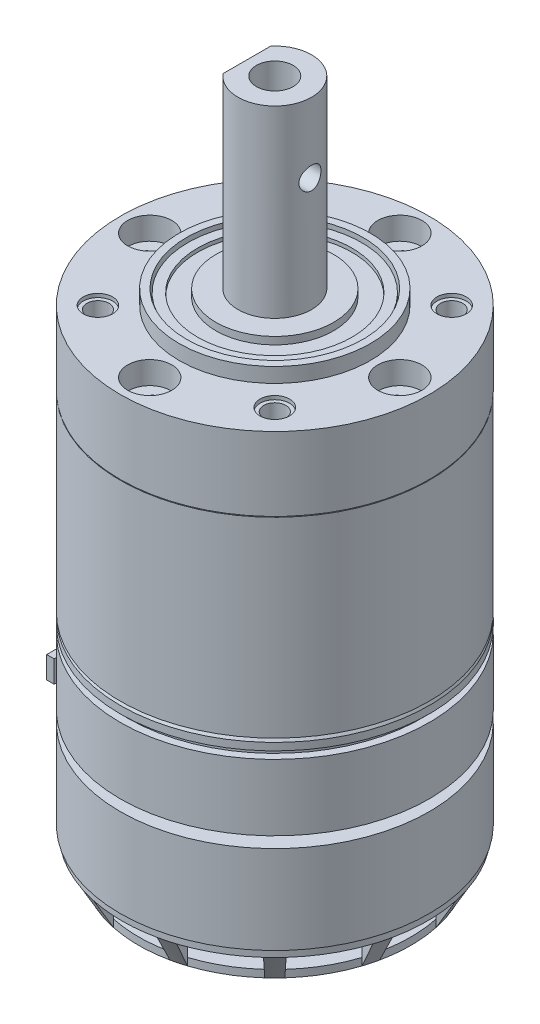
from build123d import *
from build123d.topology import SkipClean

# Parameters (mm, degrees)
SKETCH_1_R                   = 21
EXTRUDE_1_DEPTH              = 12
SKETCH_2_R                   = 10
EXTRUDE_2_DEPTH              = 1.5
SKETCH_3_R                   = 21
EXTRUDE_3_DEPTH              = 9
SKETCH_4_R                   = 20
EXTRUDE_4_DEPTH              = 1
SKETCH_5_R                   = 21
EXTRUDE_5_DEPTH              = 1
SKETCH_7_R                   = 21
EXTRUDE_6_DEPTH              = 26
SKETCH_8_R                   = 20.5
EXTRUDE_7_DEPTH              = 0.1
SKETCH_9_R                   = 21
EXTRUDE_8_DEPTH              = 10
SKETCH_11_R                  = 13
EXTRUDE_9_DEPTH              = 2
SKETCH_12_R                  = 12
SKETCH_12_R_2                = 8
CUT_EXTRUDE_1_DEPTH          = 1
EXTRUDE_START                = 0.5
SKETCH_13_R                  = 12
SKETCH_13_R_2                = 10.5
EXTRUDE_10_DEPTH             = 0.5
SKETCH_14_R                  = 12
SKETCH_14_R_2                = 11.8
CUT_EXTRUDE_2_DEPTH          = 2
SKETCH_15_R                  = 5
EXTRUDE_11_DEPTH             = 5
EXTRUDE_12_DEPTH             = 20
SKETCH_17_R                  = 1.5
CUT_EXTRUDE_3_DEPTH          = 9
SKETCH_18_R                  = 20.75
SKETCH_18_R_2                = 18.5
EXTRUDE_16_DEPTH             = 1
SKETCH_24_R                  = 18.5
EXTRUDE_17_DEPTH             = 1
CUT_EXTRUDE_START            = -4
CUT_EXTRUDE_5_DEPTH          = 4
SKETCH_26_W                  = 10
SKETCH_26_H                  = 3
CUT_EXTRUDE_6_DEPTH          = 21
SKETCH_27_R                  = 3
CUT_EXTRUDE_7_DEPTH          = 5
SKETCH_27_3_R                = 2
CUT_EXTRUDE_8_DEPTH          = 0.5
SKETCH_28_R                  = 1.5
CUT_EXTRUDE_9_DEPTH          = 4
SKETCH_29_R                  = 2.9
EXTRUDE_18_DEPTH             = 2
SKETCH_30_R                  = 3.4
EXTRUDE_19_DEPTH             = 5
EXTRUDE_19_DIRECTION_2_REACH = 99.722
SKETCH_31_R                  = 1.5
CUT_EXTRUDE_10_DEPTH         = 10
SKETCH_32_R                  = 2.5
CUT_EXTRUDE_11_DEPTH         = 50
SKETCH_33_W                  = 7.163468796
SKETCH_33_H                  = 3
SKETCH_33_W_2                = 2.188120942
SKETCH_33_H_2                = 0.9163665
SKETCH_33_W_3                = 3.449299886
SKETCH_33_H_3                = 0.550750586
EXTRUDE_20_DEPTH             = 1
EXTRUDE_21_REACH             = 94.971
EXTRUDE_21_END_RADIUS        = 22.5
SKETCH_36_W                  = 14
SKETCH_36_H                  = 4
SKETCH_36_R                  = 1.5
EXTRUDE_22_REACH             = 95.321
EXTRUDE_22_END_RADIUS        = 24
SKETCH_37_R                  = 1


with BuildPart() as part:
    # 草图1 → 凸台-拉伸1 (new body)
    with BuildSketch(Plane(origin=(0, 0, 0), x_dir=(1, 0, 0), z_dir=(0, 1, 0))):
        with Locations(Location((0, 0, 0), (0, 0, 270))):
            Circle(SKETCH_1_R)
    extrude(amount=EXTRUDE_1_DEPTH)

    # 草图2 → 凸台-拉伸2 (add)
    with BuildSketch(Plane(origin=(0, 12, 0), x_dir=(1, 0, 0), z_dir=(0, 1, 0))):
        with Locations(Location((0, 0, 0), (0, 0, 270))):
            Circle(SKETCH_2_R)
    extrude(amount=EXTRUDE_2_DEPTH)

    # 草图3 → 凸台-拉伸3 (add)
    with BuildSketch(Plane(origin=(0, 13.5, 0), x_dir=(1, 0, 0), z_dir=(0, 1, 0))):
        with Locations(Location((0, 0, 0), (0, 0, 270))):
            Circle(SKETCH_3_R)
    extrude(amount=EXTRUDE_3_DEPTH)

    # 草图4 → 凸台-拉伸4 (add)
    with BuildSketch(Plane(origin=(0, 22.5, 0), x_dir=(1, 0, 0), z_dir=(0, 1, 0))):
        with Locations(Location((0, 0, 0), (0, 0, 270))):
            Circle(SKETCH_4_R)
    extrude(amount=EXTRUDE_4_DEPTH)

    # 草图5 → 凸台-拉伸5 (add)
    with BuildSketch(Plane(origin=(0, 23.5, 0), x_dir=(1, 0, 0), z_dir=(0, 1, 0))):
        with Locations(Location((0, 0, 0), (0, 0, 270))):
            Circle(SKETCH_5_R)
    extrude(amount=EXTRUDE_5_DEPTH)

    # 草图6 → 旋转1 (revolve)
    with BuildSketch(Plane(origin=(0, 0, 0), x_dir=(0, 0, -1), z_dir=(1, 0, 0))):
        Polygon((-21, 24.5), (-20.711324865, 25), (0, 25), (0, 24.5), align=None)
    revolve(axis=Axis((0, 25, 0), (0, -1, 0)))

    # 草图7 → 凸台-拉伸6 (add)
    with BuildSketch(Plane(origin=(0, 25, 0), x_dir=(1, 0, 0), z_dir=(0, 1, 0))):
        with Locations(Location((0, 0, 0), (0, 0, 270))):
            Circle(SKETCH_7_R)
    extrude(amount=EXTRUDE_6_DEPTH)

    # 草图8 → 凸台-拉伸7 (add)
    with BuildSketch(Plane(origin=(0, 51, 0), x_dir=(1, 0, 0), z_dir=(0, 1, 0))):
        with Locations(Location((0, 0, 0), (0, 0, 270))):
            Circle(SKETCH_8_R)
    extrude(amount=EXTRUDE_7_DEPTH)

    # 草图9 → 凸台-拉伸8 (add)
    with BuildSketch(Plane(origin=(0, 51.1, 0), x_dir=(1, 0, 0), z_dir=(0, 1, 0))):
        with Locations(Location((0, 0, 0), (0, 0, 270))):
            Circle(SKETCH_9_R)
    extrude(amount=EXTRUDE_8_DEPTH)

    # 草图11 → 凸台-拉伸9 (add)
    with BuildSketch(Plane(origin=(0, 61.1, 0), x_dir=(1, 0, 0), z_dir=(0, 1, 0))):
        with Locations(Location((0, 0, 0), (0, 0, 270))):
            Circle(SKETCH_11_R)
    extrude(amount=EXTRUDE_9_DEPTH)

    # 草图12 → 切除-拉伸1 (cut)
    with BuildSketch(Plane(origin=(0, 63.1, 0), x_dir=(1, 0, 0), z_dir=(0, 1, 0))):
        with Locations(Location((0, 0, 0), (0, 0, 270))):
            Circle(SKETCH_12_R)
        with Locations(Location((0, 0, 0), (0, 0, 270))):
            Circle(SKETCH_12_R_2, mode=Mode.SUBTRACT)
    extrude(amount=-CUT_EXTRUDE_1_DEPTH, mode=Mode.SUBTRACT)

    # 草图13 → 凸台-拉伸10 (add)
    with BuildSketch(Plane(origin=(0, 62.1, 0), x_dir=(1, 0, 0), z_dir=(0, 1, 0)).offset(EXTRUDE_START)):
        with Locations(Location((0, 0, 0), (0, 0, 270))):
            Circle(SKETCH_13_R)
        with Locations(Location((0, 0, 0), (0, 0, 270))):
            Circle(SKETCH_13_R_2, mode=Mode.SUBTRACT)
    extrude(amount=-EXTRUDE_10_DEPTH)

    # 草图14 → 切除-拉伸2 (cut)
    with BuildSketch(Plane(origin=(0, 62.6, 0), x_dir=(1, 0, 0), z_dir=(0, 1, 0))):
        with Locations(Location((0, 0, 0), (0, 0, 270))):
            Circle(SKETCH_14_R)
        with Locations(Location((0, 0, 0), (0, 0, 270))):
            Circle(SKETCH_14_R_2, mode=Mode.SUBTRACT)
    extrude(amount=-CUT_EXTRUDE_2_DEPTH, mode=Mode.SUBTRACT)

    # 草图15 → 凸台-拉伸11 (add)
    with BuildSketch(Plane(origin=(0, 63.1, 0), x_dir=(1, 0, 0), z_dir=(0, 1, 0))):
        with Locations(Location((0, 0, 0), (0, 0, 270))):
            Circle(SKETCH_15_R)
    extrude(amount=EXTRUDE_11_DEPTH)

    # 草图16 → 凸台-拉伸12 (add)
    with BuildSketch(Plane(origin=(0, 68.1, 0), x_dir=(1, 0, 0), z_dir=(0, 1, 0))):
        with BuildLine():
            Line((-3.8, 3.249615362), (-3.8, -3.249615362))
            ThreePointArc((-3.8, -3.249615362), (5, 0), (-3.8, 3.249615362))
        make_face()
    extrude(amount=EXTRUDE_12_DEPTH)

    # 草图17 → 切除-拉伸3 (cut)
    with BuildSketch(Plane.ZY.offset(3.8)):
        with Locations((0, 78.6)):
            Circle(SKETCH_17_R)
    extrude(amount=-CUT_EXTRUDE_3_DEPTH, mode=Mode.SUBTRACT)

    # 草图18 → 凸台-拉伸16 (add)
    with BuildSketch(Plane.XZ):
        with Locations(Location((0, 0, 0), (0, 0, 90))):
            Circle(SKETCH_18_R)
        with Locations(Location((0, 0, 0), (0, 0, 270))):
            Circle(SKETCH_18_R_2, mode=Mode.SUBTRACT)
    extrude(amount=EXTRUDE_16_DEPTH)

    # 草图23 → 旋转2 (revolve)
    with SkipClean():  # the faces are left unmerged after this step: merging them gives an invalid solid
        with BuildSketch(Plane(origin=(0, 0, 0), x_dir=(0, 0, -1), z_dir=(1, 0, 0)), mode=Mode.PRIVATE) as revolve_2_sk:
            Polygon((-18.5, -5), (-20.75, -1), (-18.5, -1), align=None)
        revolve(revolve_2_sk.sketch.rotate(Axis((0, 0, 0), (0, -1, 0)), 130.535802111), axis=Axis((0, 0, 0), (0, -1, 0)))

    # 草图24 → 凸台-拉伸17 (add)
    with BuildSketch(Plane(origin=(0, -4, 0), x_dir=(-1, 0, 0), z_dir=(0, -1, 0))):
        with Locations(Location((0, 0, 0), (0, 0, 90))):
            Circle(SKETCH_24_R)
    extrude(amount=EXTRUDE_17_DEPTH)

    # 草图25 → 切除-拉伸5 (cut)
    with SkipClean():  # the faces are left unmerged after this step: merging them gives an invalid solid
        with BuildSketch(Plane.XZ.offset(5).offset(CUT_EXTRUDE_START)):
            with BuildLine():
                Line((-5.716814396, 17.594545551), (-6.412102633, 19.734422713))
                ThreePointArc((-6.412102633, 19.734422713), (-10.375, 17.970027129), (-13.884460082, 15.420255129))
                Line((-13.884460082, 15.420255129), (-12.378916218, 13.748179271))
                ThreePointArc((-12.378916218, 13.748179271), (-9.25, 16.02146997), (-5.716814396, 17.594545551))
            make_face()
            with BuildLine():
                ThreePointArc((4.314167584, 20.296562715), (2.168965613, 20.636329329), (0, 20.75))
                Line((0, 20.75), (0, 18.5))
                ThreePointArc((0, 18.5), (1.93377657, 18.398655064), (3.84636628, 18.095730614))
                Line((3.84636628, 18.095730614), (4.314167584, 20.296562715))
            make_face()
            with BuildLine():
                Line((0, 18.5), (0, 20.75))
                ThreePointArc((0, 20.75), (-2.168965613, 20.636329329), (-4.314167584, 20.296562715))
                Line((-4.314167584, 20.296562715), (-3.84636628, 18.095730614))
                ThreePointArc((-3.84636628, 18.095730614), (-1.93377657, 18.398655064), (0, 18.5))
            make_face()
            with BuildLine():
                ThreePointArc((13.884460082, 15.420255129), (10.375, 17.970027129), (6.412102633, 19.734422713))
                Line((6.412102633, 19.734422713), (5.716814396, 17.594545551))
                ThreePointArc((5.716814396, 17.594545551), (9.25, 16.02146997), (12.378916218, 13.748179271))
                Line((12.378916218, 13.748179271), (13.884460082, 15.420255129))
            make_face()
            with BuildLine():
                ThreePointArc((19.734422713, 6.412102633), (17.970027129, 10.375), (15.420255129, 13.884460082))
                Line((15.420255129, 13.884460082), (13.748179271, 12.378916218))
                ThreePointArc((13.748179271, 12.378916218), (16.02146997, 9.25), (17.594545551, 5.716814396))
                Line((17.594545551, 5.716814396), (19.734422713, 6.412102633))
            make_face()
            with BuildLine():
                ThreePointArc((20.75, 0), (20.636329329, 2.168965613), (20.296562715, 4.314167584))
                Line((20.296562715, 4.314167584), (18.095730614, 3.84636628))
                ThreePointArc((18.095730614, 3.84636628), (18.398655064, 1.93377657), (18.5, 0))
                ThreePointArc((18.5, 0), (18.398655064, -1.93377657), (18.095730614, -3.84636628))
                Line((18.095730614, -3.84636628), (20.296562715, -4.314167584))
                ThreePointArc((20.296562715, -4.314167584), (20.636329329, -2.168965613), (20.75, 0))
            make_face()
            with BuildLine():
                ThreePointArc((17.594545551, -5.716814396), (16.02146997, -9.25), (13.748179271, -12.378916218))
                Line((13.748179271, -12.378916218), (15.420255129, -13.884460082))
                ThreePointArc((15.420255129, -13.884460082), (17.970027129, -10.375), (19.734422713, -6.412102633))
                Line((19.734422713, -6.412102633), (17.594545551, -5.716814396))
            make_face()
            with BuildLine():
                ThreePointArc((12.378916218, -13.748179271), (9.25, -16.02146997), (5.716814396, -17.594545551))
                Line((5.716814396, -17.594545551), (6.412102633, -19.734422713))
                ThreePointArc((6.412102633, -19.734422713), (10.375, -17.970027129), (13.884460082, -15.420255129))
                Line((13.884460082, -15.420255129), (12.378916218, -13.748179271))
            make_face()
            with BuildLine():
                ThreePointArc((3.84636628, -18.095730614), (1.93377657, -18.398655064), (0, -18.5))
                Line((0, -18.5), (0, -20.75))
                ThreePointArc((0, -20.75), (2.168965613, -20.636329329), (4.314167584, -20.296562715))
                Line((4.314167584, -20.296562715), (3.84636628, -18.095730614))
            make_face()
            with BuildLine():
                Line((0, -20.75), (0, -18.5))
                ThreePointArc((0, -18.5), (-1.93377657, -18.398655064), (-3.84636628, -18.095730614))
                Line((-3.84636628, -18.095730614), (-4.314167584, -20.296562715))
                ThreePointArc((-4.314167584, -20.296562715), (-2.168965613, -20.636329329), (0, -20.75))
            make_face()
            with BuildLine():
                Line((-6.412102633, -19.734422713), (-5.716814396, -17.594545551))
                ThreePointArc((-5.716814396, -17.594545551), (-9.25, -16.02146997), (-12.378916218, -13.748179271))
                Line((-12.378916218, -13.748179271), (-13.884460082, -15.420255129))
                ThreePointArc((-13.884460082, -15.420255129), (-10.375, -17.970027129), (-6.412102633, -19.734422713))
            make_face()
            with BuildLine():
                Line((-15.420255129, -13.884460082), (-13.748179271, -12.378916218))
                ThreePointArc((-13.748179271, -12.378916218), (-16.02146997, -9.25), (-17.594545551, -5.716814396))
                Line((-17.594545551, -5.716814396), (-19.734422713, -6.412102633))
                ThreePointArc((-19.734422713, -6.412102633), (-17.970027129, -10.375), (-15.420255129, -13.884460082))
            make_face()
            with BuildLine():
                Line((-18.095730614, 3.84636628), (-20.296562715, 4.314167584))
                ThreePointArc((-20.296562715, 4.314167584), (-20.75, 0), (-20.296562715, -4.314167584))
                Line((-20.296562715, -4.314167584), (-18.095730614, -3.84636628))
                ThreePointArc((-18.095730614, -3.84636628), (-18.5, 0), (-18.095730614, 3.84636628))
            make_face()
            with BuildLine():
                Line((-13.748179271, 12.378916218), (-15.420255129, 13.884460082))
                ThreePointArc((-15.420255129, 13.884460082), (-17.970027129, 10.375), (-19.734422713, 6.412102633))
                Line((-19.734422713, 6.412102633), (-17.594545551, 5.716814396))
                ThreePointArc((-17.594545551, 5.716814396), (-16.02146997, 9.25), (-13.748179271, 12.378916218))
            make_face()
        extrude(amount=CUT_EXTRUDE_5_DEPTH, mode=Mode.SUBTRACT)

    # 草图26 → 切除-拉伸6 (cut)
    with SkipClean():  # the faces are left unmerged after this step: merging them gives an invalid solid
        with BuildSketch(Plane(origin=(0, 0, 0), x_dir=(0, 0, -1), z_dir=(1, 0, 0))):
            with Locations((-10, 18)):
                Rectangle(SKETCH_26_W, SKETCH_26_H)
        extrude(amount=-CUT_EXTRUDE_6_DEPTH, mode=Mode.SUBTRACT)

    # 草图27 → 切除-拉伸7 (cut)
    with SkipClean():  # the faces are left unmerged after this step: merging them gives an invalid solid
        with BuildSketch(Plane(origin=(0, 61.1, 0), x_dir=(1, 0, 0), z_dir=(0, 1, 0))):
            with Locations(Location((0, 17, 0), (0, 0, 270))):
                Circle(SKETCH_27_R)
            with Locations(Location((-17, 0, 0), (0, 0, 270))):
                Circle(SKETCH_27_R)
            with Locations(Location((0, -17, 0), (0, 0, 270))):
                Circle(SKETCH_27_R)
            with Locations(Location((17, 0, 0), (0, 0, 270))):
                Circle(SKETCH_27_R)
        extrude(amount=-CUT_EXTRUDE_7_DEPTH, mode=Mode.SUBTRACT)

    # 草图27<3> → 切除-拉伸8 (cut)
    with SkipClean():  # the faces are left unmerged after this step: merging them gives an invalid solid
        with BuildSketch(Plane(origin=(0, 61.1, 0), x_dir=(1, 0, 0), z_dir=(0, 1, 0))):
            with Locations(Location((-12.02081528, 12.02081528, 0), (0, 0, 270))):
                Circle(SKETCH_27_3_R)
            with Locations(Location((12.02081528, -12.02081528, 0), (0, 0, 270))):
                Circle(SKETCH_27_3_R)
            with Locations(Location((-12.02081528, -12.02081528, 0), (0, 0, 270))):
                Circle(SKETCH_27_3_R)
            with Locations(Location((12.02081528, 12.02081528, 0), (0, 0, 270))):
                Circle(SKETCH_27_3_R)
        extrude(amount=-CUT_EXTRUDE_8_DEPTH, mode=Mode.SUBTRACT)

    # 草图28 → 切除-拉伸9 (cut)
    with SkipClean():  # the faces are left unmerged after this step: merging them gives an invalid solid
        with BuildSketch(Plane(origin=(0, 60.6, 0), x_dir=(1, 0, 0), z_dir=(0, 1, 0))):
            with Locations(Location((-12.02081528, 12.02081528, 0), (0, 0, 270))):
                Circle(SKETCH_28_R)
            with Locations(Location((12.02081528, 12.02081528, 0), (0, 0, 270))):
                Circle(SKETCH_28_R)
            with Locations(Location((12.02081528, -12.02081528, 0), (0, 0, 270))):
                Circle(SKETCH_28_R)
            with Locations(Location((-12.02081528, -12.02081528, 0), (0, 0, 270))):
                Circle(SKETCH_28_R)
        extrude(amount=-CUT_EXTRUDE_9_DEPTH, mode=Mode.SUBTRACT)

    # 草图29 → 凸台-拉伸18 (add)
    # profile 1 of 4: a face of its own
    with SkipClean():  # the faces are left unmerged after this step: merging them gives an invalid solid
        with BuildSketch(Plane(origin=(0, 56.1, 0), x_dir=(1, 0, 0), z_dir=(0, 1, 0))):
            with Locations(Location((0, 17, 0), (0, 0, 270))):
                Circle(SKETCH_29_R)
            Polygon((1.413561219, 17), (0.706780609, 18.224179925), (-0.706780609, 18.224179925), (-1.413561219, 17), (-0.706780609, 15.775820075), (0.706780609, 15.775820075), align=None, mode=Mode.SUBTRACT)
        # profile 2 of 4: a face of its own
        with BuildSketch(Plane(origin=(0, 56.1, 0), x_dir=(1, 0, 0), z_dir=(0, 1, 0))):
            with Locations(Location((17, 0, 0), (0, 0, 270))):
                Circle(SKETCH_29_R)
            Polygon((17, -1.413561219), (18.224179925, -0.706780609), (18.224179925, 0.70678061), (17, 1.413561219), (15.775820075, 0.70678061), (15.775820075, -0.706780609), align=None, mode=Mode.SUBTRACT)
        # profile 3 of 4: a face of its own
        with BuildSketch(Plane(origin=(0, 56.1, 0), x_dir=(1, 0, 0), z_dir=(0, 1, 0))):
            with Locations(Location((0, -17, 0), (0, 0, 270))):
                Circle(SKETCH_29_R)
            Polygon((-1.413561219, -17), (-0.706780609, -18.224179925), (0.70678061, -18.224179925), (1.413561219, -17), (0.70678061, -15.775820075), (-0.706780609, -15.775820075), align=None, mode=Mode.SUBTRACT)
        # profile 4 of 4: a face of its own
        with BuildSketch(Plane(origin=(0, 56.1, 0), x_dir=(1, 0, 0), z_dir=(0, 1, 0))):
            with Locations(Location((-17, 0, 0), (0, 0, 270))):
                Circle(SKETCH_29_R)
            Polygon((-17, 1.413561219), (-18.224179925, 0.706780609), (-18.224179925, -0.70678061), (-17, -1.413561219), (-15.775820075, -0.70678061), (-15.775820075, 0.706780609), align=None, mode=Mode.SUBTRACT)
        extrude(amount=EXTRUDE_18_DEPTH)

    # 草图30 → 凸台-拉伸19 (add)
    with SkipClean():  # the faces are left unmerged after this step: merging them gives an invalid solid
        with BuildSketch(Plane.XZ.offset(5)):
            with Locations(Location((0, 0, 0), (0, 0, 270))):
                Circle(SKETCH_30_R)
        extrude(amount=EXTRUDE_19_DEPTH)

    # 凸台-拉伸19 direction 2: up to this face of the body (flat: up to its plane)
    extrude_19_direction_2_end = Plane(part.part.faces().sort_by_distance((0, 0, 0))[0])
    # 草图30 → 凸台-拉伸19 direction 2 (add, up to the picked face)
    with BuildSketch(Plane.XZ.offset(5), mode=Mode.PRIVATE) as extrude_19_direction_2_sk1:
        with Locations(Location((0, 0, 0), (0, 0, 270))):
            Circle(SKETCH_30_R)
    extrude_19_direction_2_tool1 = split(extrude(extrude_19_direction_2_sk1.sketch, amount=-EXTRUDE_19_DIRECTION_2_REACH, mode=Mode.PRIVATE), bisect_by=extrude_19_direction_2_end, keep=Keep.BOTH, mode=Mode.PRIVATE)
    add(extrude_19_direction_2_tool1.solids().sort_by(Axis((0, -5, 0), (0, 1, 0)))[0])

    # 草图31 → 切除-拉伸10 (cut)
    with SkipClean():  # the faces are left unmerged after this step: merging them gives an invalid solid
        with BuildSketch(Plane.XZ.offset(5)):
            with Locations(Location((5.5, 0, 0), (0, 0, 270))):
                Circle(SKETCH_31_R)
            with Locations(Location((-5.5, 0, 0), (0, 0, 270))):
                Circle(SKETCH_31_R)
        extrude(amount=-CUT_EXTRUDE_10_DEPTH, mode=Mode.SUBTRACT)

    # 草图32 → 切除-拉伸11 (cut)
    with SkipClean():  # the faces are left unmerged after this step: merging them gives an invalid solid
        with BuildSketch(Plane(origin=(0, 88.1, 0), x_dir=(1, 0, 0), z_dir=(0, 1, 0))):
            with Locations(Location((0, 0, 0), (0, 0, 270))):
                Circle(SKETCH_32_R)
        extrude(amount=-CUT_EXTRUDE_11_DEPTH, mode=Mode.SUBTRACT)

    # 草图33 → 凸台-拉伸20 (add)
    with SkipClean():  # the faces are left unmerged after this step: merging them gives an invalid solid
        with BuildSketch(Plane.ZY.offset(16)):
            with Locations((11.418265602, 18)):
                Rectangle(SKETCH_33_W, SKETCH_33_H)
            with Locations((9.698545065, 18.720204381)):
                Rectangle(SKETCH_33_W_2, SKETCH_33_H_2, mode=Mode.SUBTRACT)
            with Locations((11.418265602, 17.874643498)):
                Rectangle(SKETCH_33_W_3, SKETCH_33_H_3, mode=Mode.SUBTRACT)
            Polygon((8.351158704, 17.309628516), (8.351158704, 16.559862621), (14.4853725, 16.559862621), (14.4853725, 17.309628516), (14.4853725, 17.784396257), (14.13846098, 17.784396257), (14.13846098, 17.309628516), (8.698070224, 17.309628516), (8.698070224, 17.784396257), (8.351158704, 17.784396257), align=None, mode=Mode.SUBTRACT)
            with Locations((13.137986139, 18.720204381)):
                Rectangle(SKETCH_33_W_2, SKETCH_33_H_2, mode=Mode.SUBTRACT)
        extrude(amount=-EXTRUDE_20_DEPTH)

    # 凸台-拉伸21: up to this cylinder (the profile starts inside it)
    with SkipClean():  # the faces are left unmerged after this step: merging them gives an invalid solid
        extrude_21_end = Plane(origin=(0, 19.854398, 0), z_dir=(0, -1, 0)) * Cylinder(EXTRUDE_21_END_RADIUS, 235.942, mode=Mode.PRIVATE)
        # 草图36 → 凸台-拉伸21 (add, up to the surface)
        with BuildSketch(Plane.ZY, mode=Mode.PRIVATE) as extrude_21_sk1:
            with Locations((-3.90502478, 18)):
                Rectangle(SKETCH_36_W, SKETCH_36_H)
            with Locations(Location((0.495914767, 18, 0), (0, 0, 180))):
                Circle(SKETCH_36_R, mode=Mode.SUBTRACT)
            with Locations(Location((-4.004085233, 18, 0), (0, 0, 180))):
                Circle(SKETCH_36_R, mode=Mode.SUBTRACT)
            with Locations(Location((-8.504085233, 18, 0), (0, 0, 180))):
                Circle(SKETCH_36_R, mode=Mode.SUBTRACT)
        extrude_21_tool1 = extrude(extrude_21_sk1.sketch, amount=EXTRUDE_21_REACH, mode=Mode.PRIVATE) & extrude_21_end
        add(extrude_21_tool1.solids().sort_by_distance((0, 19.854398, -3.905025))[0])

    # 凸台-拉伸22: up to this cylinder (the profile starts inside it)
    with SkipClean():  # the faces are left unmerged after this step: merging them gives an invalid solid
        extrude_22_end = Plane(origin=(0, 18, 0), z_dir=(0, -1, 0)) * Cylinder(EXTRUDE_22_END_RADIUS, 239.642, mode=Mode.PRIVATE)
        # 草图37 → 凸台-拉伸22 (add, up to the surface)
        with BuildSketch(Plane(origin=(0, 0, 0), x_dir=(0, 0, -1), z_dir=(1, 0, 0)), mode=Mode.PRIVATE) as extrude_22_sk1:
            with Locations((8.504085233, 18)):
                Circle(SKETCH_37_R)
        extrude_22_tool1 = extrude(extrude_22_sk1.sketch, amount=-EXTRUDE_22_REACH, mode=Mode.PRIVATE) & extrude_22_end
        add(extrude_22_tool1.solids().sort_by_distance((0, 18, -8.504085))[0])
        # 草图37 → 凸台-拉伸22 (add, up to the surface)
        with BuildSketch(Plane(origin=(0, 0, 0), x_dir=(0, 0, -1), z_dir=(1, 0, 0)), mode=Mode.PRIVATE) as extrude_22_sk2:
            with Locations((4.004085233, 18)):
                Circle(SKETCH_37_R)
        extrude_22_tool2 = extrude(extrude_22_sk2.sketch, amount=-EXTRUDE_22_REACH, mode=Mode.PRIVATE) & extrude_22_end
        add(extrude_22_tool2.solids().sort_by_distance((0, 18, -4.004085))[0])
        # 草图37 → 凸台-拉伸22 (add, up to the surface)
        with BuildSketch(Plane(origin=(0, 0, 0), x_dir=(0, 0, -1), z_dir=(1, 0, 0)), mode=Mode.PRIVATE) as extrude_22_sk3:
            with Locations((-0.495914767, 18)):
                Circle(SKETCH_37_R)
        extrude_22_tool3 = extrude(extrude_22_sk3.sketch, amount=-EXTRUDE_22_REACH, mode=Mode.PRIVATE) & extrude_22_end
        add(extrude_22_tool3.solids().sort_by_distance((0, 18, 0.495915))[0])


solid = part.part
